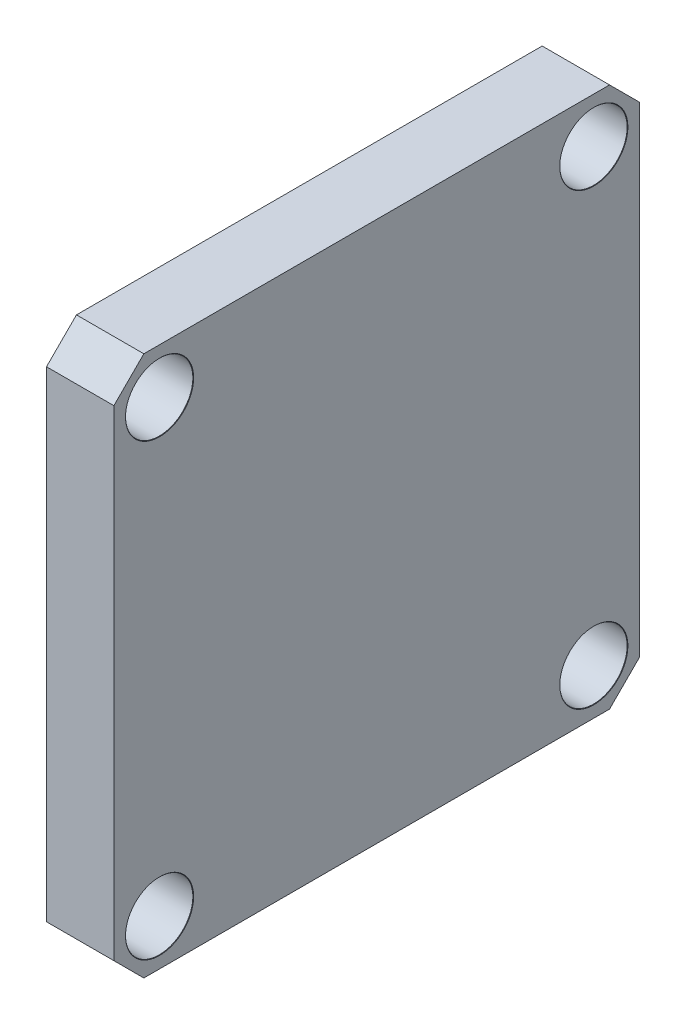
from build123d import *

# Parameters (mm, degrees)
SKETCH_1_W                  = 35.1
SKETCH_1_H                  = 36.1
EXTRUDE_1_DEPTH             = 4.5
CHAMFER_1_SIZE              = 2
HOLE_WIZARD_M41_D           = 4.5
HOLE_WIZARD_M41_CSINK_D     = 4.55
HOLE_WIZARD_M41_CSINK_ANGLE = 90


with BuildPart() as part:
    # Эскиз1 → Бобышка-Вытянуть1 (new body)
    with BuildSketch(Plane(origin=(0, 0, 0), x_dir=(0, 0, -1), z_dir=(1, 0, 0))):
        Rectangle(SKETCH_1_W, SKETCH_1_H)
    extrude(amount=EXTRUDE_1_DEPTH)

    # Фаска1
    chamfer_1_edges = [part.edges().sort_by_distance(p)[0] for p in [
        (2.25, -18.05, -17.55),
        (2.25, 18.05, -17.55),
        (2.25, -18.05, 17.55),
        (2.25, 18.05, 17.55),
    ]]
    chamfer(chamfer_1_edges, length=CHAMFER_1_SIZE)

    # Отверстие с зазором M41 (through all)
    with Locations(Plane(origin=(4.5, 15, -14.5), x_dir=(0, 0, 1), z_dir=(1, 0, 0))):
        with Locations((0, 0), (29, 0), (29, 30), (0, 30)):
            CounterSinkHole(HOLE_WIZARD_M41_D / 2, HOLE_WIZARD_M41_CSINK_D / 2, counter_sink_angle=HOLE_WIZARD_M41_CSINK_ANGLE)


solid = part.part
